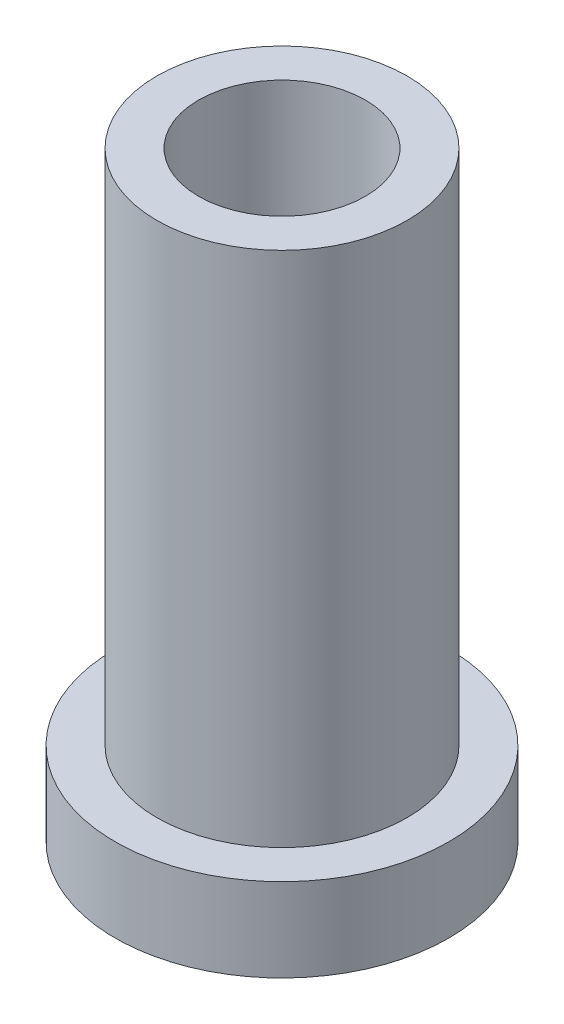
from build123d import *

# Parameters (mm, degrees)
SKETCH2_R          = 5
CUT_EXTRUDE1_DEPTH = 39.678159212


with BuildPart() as part:
    # Sketch1 → Revolve1 (revolve)
    with BuildSketch(Plane.XY, mode=Mode.PRIVATE) as revolve1_sk:
        Polygon((0, 0), (10, 0), (10, 5), (7.5, 5), (7.5, 36), (0, 36), align=None)
    revolve(revolve1_sk.sketch.rotate(Axis((0, 41, 0), (0, -1, 0)), 180), axis=Axis((0, 41, 0), (0, -1, 0)))

    # Sketch2 → Cut-Extrude1 (cut, through all)
    with BuildSketch(Plane(origin=(0, 36, 0), x_dir=(1, 0, 0), z_dir=(0, 1, 0))):
        with Locations(Location((0, 0, 0), (0, 0, 180))):
            Circle(SKETCH2_R)
    extrude(amount=-CUT_EXTRUDE1_DEPTH, mode=Mode.SUBTRACT)


solid = part.part
